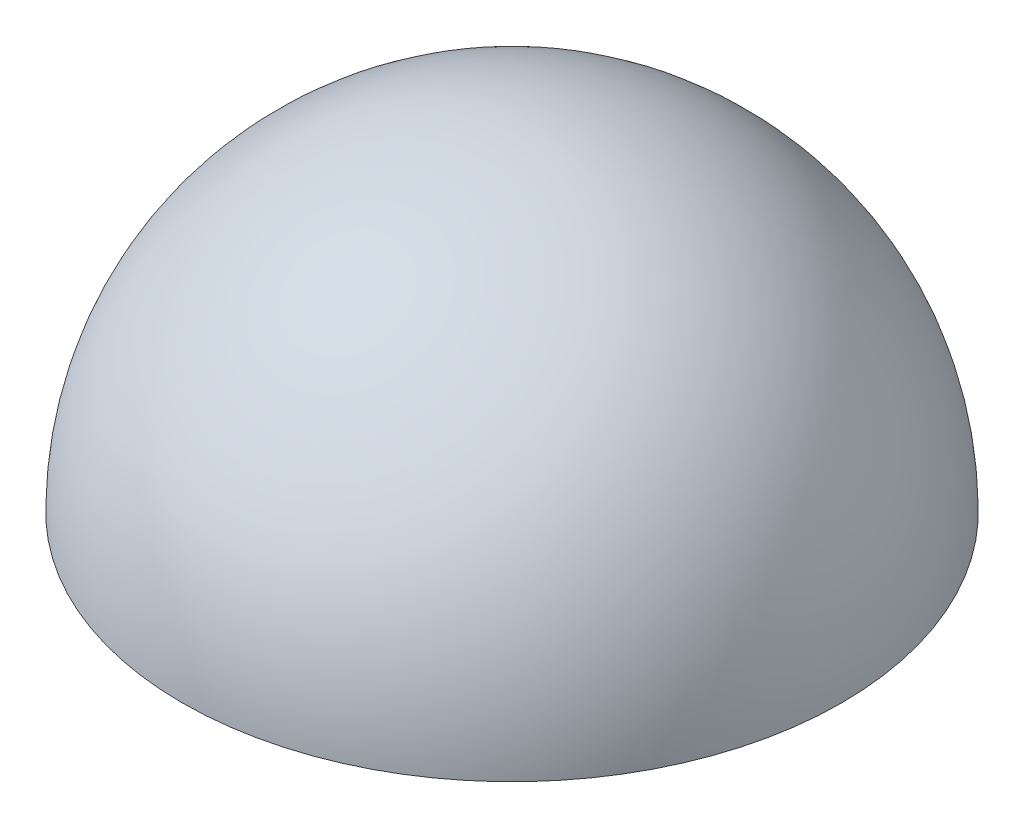
from build123d import *


with BuildPart() as part:
    # Sketch1 → Revolve1 (revolve)
    with BuildSketch(Plane.XY):
        with BuildLine():
            Line((0, 294.386), (0, 298.45))
            ThreePointArc((0, 298.45), (-211.036018845, 211.036018845), (-298.45, 0))
            Line((-298.45, 0), (-294.386, 0))
            ThreePointArc((-294.386, 0), (-208.162336886, 208.162336886), (0, 294.386))
        make_face()
    revolve(axis=Axis((0, 298.45, 0), (0, -1, 0)))


solid = part.part
